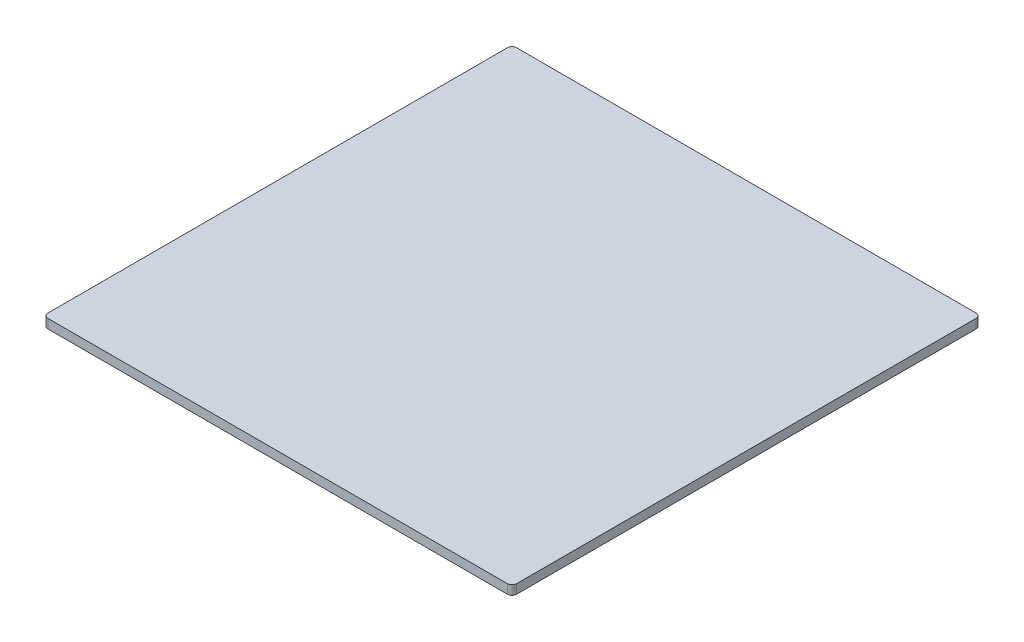
from build123d import *

# Parameters (mm, degrees)
RESSALTO_EXTRUS_O1_DEPTH = 2


with BuildPart() as part:
    # Esboço1 → Ressalto-extrusão1 (new body)
    with BuildSketch(Plane(origin=(0, 0, 0), x_dir=(1, 0, 0), z_dir=(0, 1, 0))):
        with BuildLine():
            Line((-26.702808043, 160.616125956), (73.297191957, 160.616125956))
            ThreePointArc((73.297191957, 160.616125956), (74.004298738, 160.323232737), (74.297191957, 159.616125956))
            Line((74.297191957, 159.616125956), (74.297191957, 59.616125956))
            ThreePointArc((74.297191957, 59.616125956), (74.004298738, 58.909019175), (73.297191957, 58.616125956))
            Line((73.297191957, 58.616125956), (-26.702808043, 58.616125956))
            ThreePointArc((-26.702808043, 58.616125956), (-27.409914824, 58.909019175), (-27.702808043, 59.616125956))
            Line((-27.702808043, 59.616125956), (-27.702808043, 159.616125956))
            ThreePointArc((-27.702808043, 159.616125956), (-27.409914824, 160.323232737), (-26.702808043, 160.616125956))
        make_face()
    extrude(amount=RESSALTO_EXTRUS_O1_DEPTH)


solid = part.part
